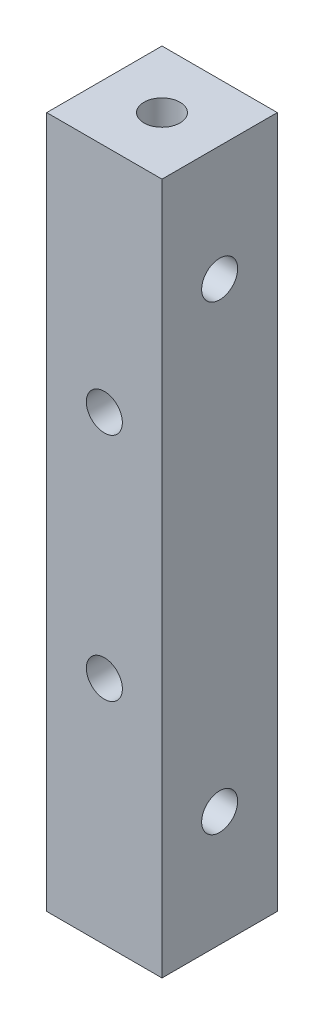
from build123d import *

# Parameters (mm, degrees)
SKETCH_1_W         = 8
SKETCH_1_H         = 8
EXTRUDE_1_DEPTH    = 24
HOLE_WIZARD_M3_1_D = 2.5
HOLE_WIZARD_M3_2_D = 2.5
HOLE_WIZARD_M3_3_D = 2.5


with BuildPart() as part:
    # 草图1 → 凸台-拉伸1 (new, symmetric)
    with BuildSketch(Plane(origin=(0, 0, 0), x_dir=(1, 0, 0), z_dir=(0, 1, 0))):
        Rectangle(SKETCH_1_W, SKETCH_1_H)
    extrude(amount=EXTRUDE_1_DEPTH, both=True)

    # M3 螺纹孔1 (through all)
    with Locations(Plane.XY.offset(4)):
        with Locations((0, 8), (0, -8)):
            Hole(HOLE_WIZARD_M3_1_D / 2)

    # M3 螺纹孔2 (through all)
    with Locations(Plane(origin=(4, 0, 0), x_dir=(0, 0, -1), z_dir=(1, 0, 0))):
        with Locations((0, 16), (0, -16)):
            Hole(HOLE_WIZARD_M3_2_D / 2)

    # M3 螺纹孔3 (through all)
    with Locations(Plane(origin=(0, -24, 0), x_dir=(-1, 0, 0), z_dir=(0, -1, 0))):
        with Locations((0, 0)):
            Hole(HOLE_WIZARD_M3_3_D / 2)


solid = part.part
